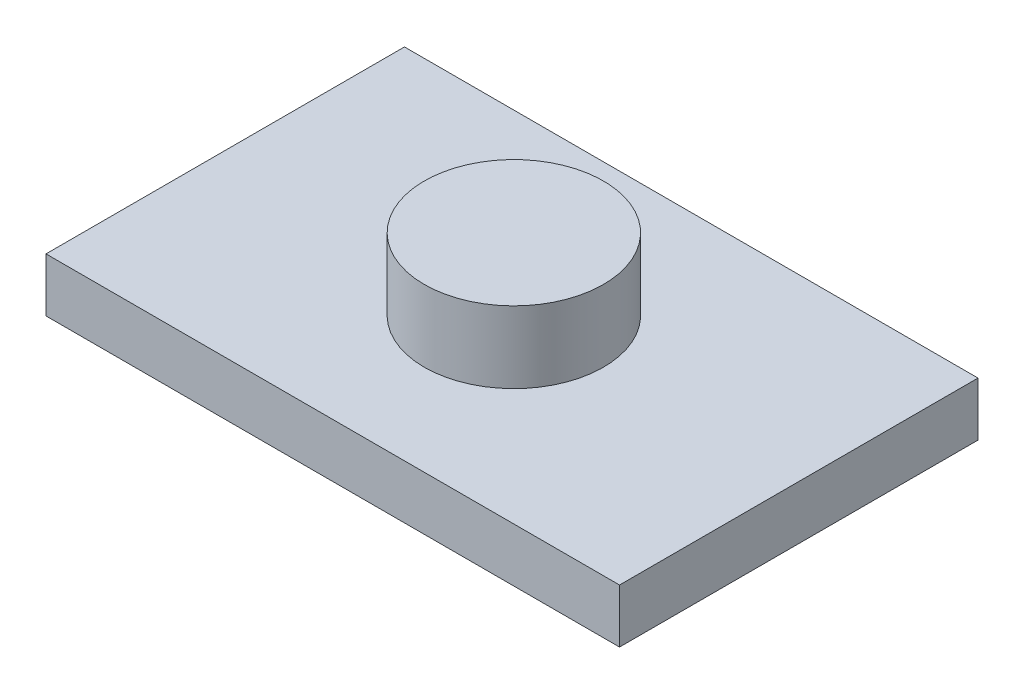
from build123d import *

# Parameters (mm, degrees)
SKETCH1_W   = 101.6
SKETCH1_H   = 63.5
PLATE_DEPTH = 9.525
SKETCH2_R   = 15.875
BOSS_DEPTH  = 12.7


with BuildPart() as part:
    # Sketch1 → Plate (new body)
    with BuildSketch(Plane(origin=(0, 0, 0), x_dir=(1, 0, 0), z_dir=(0, 1, 0))):
        with Locations((1845.670588235, 897.661764706)):
            Rectangle(SKETCH1_W, SKETCH1_H)
    extrude(amount=PLATE_DEPTH)

    # Sketch2 → Boss (add)
    with BuildSketch(Plane(origin=(0, 9.525, 0), x_dir=(1, 0, 0), z_dir=(0, 1, 0))):
        with Locations(Location((1845.765079399, 897.897992616, 0), (0, 0, 270))):
            Circle(SKETCH2_R)
    extrude(amount=BOSS_DEPTH)


solid = part.part
